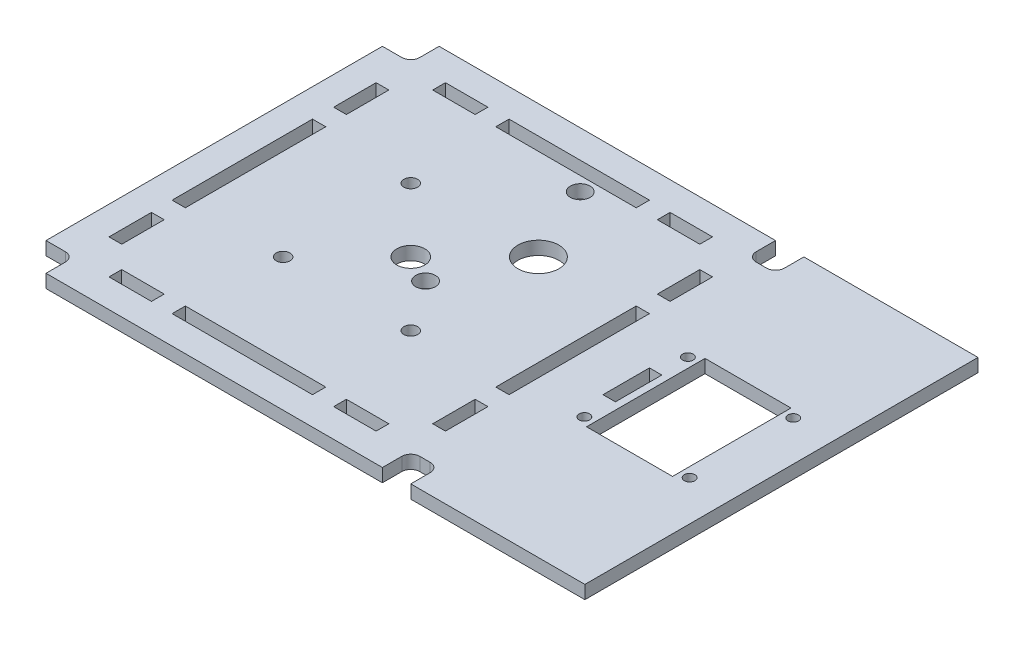
from build123d import *

# Parameters (mm, degrees)
EXTRUDE_1_DEPTH     = 88.9
SKETCH_4_R          = 1.5
SKETCH_4_W          = 31.75
SKETCH_4_H          = 3
SKETCH_4_W_2        = 3
SKETCH_4_H_2        = 31.75
CUT_EXTRUDE_1_DEPTH = 3
SKETCH_5_R          = 1.56
CUT_EXTRUDE_2_DEPTH = 3
SKETCH_7_R          = 4.635
SKETCH_7_R_2        = 2.23
CUT_EXTRUDE_3_DEPTH = 3
SKETCH_8_W          = 9.6
SKETCH_8_H          = 2.88
SKETCH_8_W_2        = 2.88
SKETCH_8_H_2        = 9.6
CUT_EXTRUDE_4_DEPTH = 3
SKETCH_9_R          = 3.175
CUT_EXTRUDE_5_DEPTH = 3
SKETCH_13_W         = 6.4135
SKETCH_13_H         = 6.4135
CUT_EXTRUDE_7_DEPTH = 5.08
FILLET_2_R          = 2.032
SKETCH_18_R         = 1.190625
SKETCH_18_W         = 19.446875
SKETCH_18_H         = 26.7890625
CUT_EXTRUDE_8_DEPTH = 3
SKETCH_19_W         = 2.804
SKETCH_19_H         = 10.5
CUT_EXTRUDE_9_DEPTH = 2000


with BuildPart() as part:
    # 스케치2 → 보스-돌출1 (new body)
    with BuildSketch(Plane.XY):
        Polygon((-44.45, 1.5), (44.45, 1.5), (83.82, 1.5), (83.82, -1.5), (44.45, -1.5), (-44.45, -1.5), align=None)
    extrude(amount=EXTRUDE_1_DEPTH)

    # 스케치4 → 컷-돌출1 (cut)
    with BuildSketch(Plane(origin=(0, 1.5, 0), x_dir=(1, 0, 0), z_dir=(0, 1, 0))):
        with Locations(Location((-41.275, -85.725, 0), (0, 0, 270))):
            Circle(SKETCH_4_R)
        with Locations(Location((-41.275, -3.175, 0), (0, 0, 270))):
            Circle(SKETCH_4_R)
        with Locations(Location((41.275, -3.175, 0), (0, 0, 270))):
            Circle(SKETCH_4_R)
        with Locations(Location((41.275, -85.725, 0), (0, 0, 270))):
            Circle(SKETCH_4_R)
        with Locations((0, -81.05)):
            Rectangle(SKETCH_4_W, SKETCH_4_H)
        with Locations((-36.6, -44.45)):
            Rectangle(SKETCH_4_W_2, SKETCH_4_H_2)
        with Locations((0, -7.85)):
            Rectangle(SKETCH_4_W, SKETCH_4_H)
        with Locations((36.6, -44.45)):
            Rectangle(SKETCH_4_W_2, SKETCH_4_H_2)
    extrude(amount=-CUT_EXTRUDE_1_DEPTH, mode=Mode.SUBTRACT)

    # 스케치5 → 컷-돌출2 (cut)
    with BuildSketch(Plane(origin=(0, 1.5, 0), x_dir=(1, 0, 0), z_dir=(0, 1, 0))):
        with Locations(Location((-14.431818182, -30.018181818, 0), (0, 0, 270))):
            Circle(SKETCH_5_R)
        with Locations(Location((14.431818182, -30.018181818, 0), (0, 0, 270))):
            Circle(SKETCH_5_R)
        with Locations(Location((14.431818182, -58.881818182, 0), (0, 0, 270))):
            Circle(SKETCH_5_R)
        with Locations(Location((-14.431818182, -58.881818182, 0), (0, 0, 270))):
            Circle(SKETCH_5_R)
    extrude(amount=-CUT_EXTRUDE_2_DEPTH, mode=Mode.SUBTRACT)

    # 스케치7 → 컷-돌출3 (cut)
    with BuildSketch(Plane(origin=(0, 1.5, 0), x_dir=(1, 0, 0), z_dir=(0, 1, 0))):
        with Locations(Location((14.431818182, -30.018181818, 0), (0, 0, 270))):
            Circle(SKETCH_7_R)
        with Locations((6.401818182, -47.508181818)):
            Circle(SKETCH_7_R_2)
        with Locations((6.401818182, -12.528181818)):
            Circle(SKETCH_7_R_2)
    extrude(amount=-CUT_EXTRUDE_3_DEPTH, mode=Mode.SUBTRACT)

    # 스케치8 → 컷-돌출4 (cut)
    with BuildSketch(Plane(origin=(0, 1.5, 0), x_dir=(1, 0, 0), z_dir=(0, 1, 0))):
        with Locations((-25.4, -7.85)):
            Rectangle(SKETCH_8_W, SKETCH_8_H)
        with Locations((-36.6, -19.05)):
            Rectangle(SKETCH_8_W_2, SKETCH_8_H_2)
        with Locations((36.6, -19.05)):
            Rectangle(SKETCH_8_W_2, SKETCH_8_H_2)
        with Locations((25.4, -7.85)):
            Rectangle(SKETCH_8_W, SKETCH_8_H)
        with Locations((36.6, -69.85)):
            Rectangle(SKETCH_8_W_2, SKETCH_8_H_2)
        with Locations((25.4, -81.05)):
            Rectangle(SKETCH_8_W, SKETCH_8_H)
        with Locations((-25.4, -81.05)):
            Rectangle(SKETCH_8_W, SKETCH_8_H)
        with Locations((-36.6, -69.85)):
            Rectangle(SKETCH_8_W_2, SKETCH_8_H_2)
    extrude(amount=-CUT_EXTRUDE_4_DEPTH, mode=Mode.SUBTRACT)

    # 스케치9 → 컷-돌출5 (cut)
    with BuildSketch(Plane(origin=(0, 1.5, 0), x_dir=(1, 0, 0), z_dir=(0, 1, 0))):
        with Locations(Location((0, -44.45, 0), (0, 0, 270))):
            Circle(SKETCH_9_R)
    extrude(amount=-CUT_EXTRUDE_5_DEPTH, mode=Mode.SUBTRACT)

    # 스케치13 → 컷-돌출7 (cut)
    with BuildSketch(Plane(origin=(0, 1.5, 0), x_dir=(1, 0, 0), z_dir=(0, 1, 0))):
        with Locations((-41.24325, -85.69325)):
            Rectangle(SKETCH_13_W, SKETCH_13_H)
        with Locations((-41.24325, -3.20675)):
            Rectangle(SKETCH_13_W, SKETCH_13_H)
        with Locations((41.24325, -3.20675)):
            Rectangle(SKETCH_13_W, SKETCH_13_H)
        with Locations((41.24325, -85.69325)):
            Rectangle(SKETCH_13_W, SKETCH_13_H)
    extrude(amount=-CUT_EXTRUDE_7_DEPTH, mode=Mode.SUBTRACT)

    # 필렛2
    fillet_2_edges = [part.edges().sort_by_distance(p)[0] for p in [
        (44.45, 0, 82.4865),
        (38.0365, 0, 82.4865),
        (44.45, 0, 6.4135),
        (38.0365, 0, 6.4135),
        (-38.0365, 0, 6.4135),
        (-38.0365, 0, 82.4865),
    ]]
    fillet(fillet_2_edges, radius=FILLET_2_R)

    # 스케치18 → 컷-돌출8 (cut)
    with BuildSketch(Plane(origin=(0, 1.5, 0), x_dir=(1, 0, 0), z_dir=(0, 1, 0))):
        with Locations(Location((50.95875, -56.1578125, 0), (0, 0, 180))):
            Circle(SKETCH_18_R)
        with Locations(Location((50.95875, -32.7421875, 0), (0, 0, 180))):
            Circle(SKETCH_18_R)
        with Locations((74.77125, -32.7421875)):
            Circle(SKETCH_18_R)
        with Locations((74.77125, -56.1578125)):
            Circle(SKETCH_18_R)
        with Locations((62.865, -44.45)):
            Rectangle(SKETCH_18_W, SKETCH_18_H)
    extrude(amount=-CUT_EXTRUDE_8_DEPTH, mode=Mode.SUBTRACT)

    # 스케치19 → 컷-돌출9 (cut)
    with BuildSketch(Plane(origin=(0, 1.5, 0), x_dir=(1, 0, 0), z_dir=(0, 1, 0))):
        with Locations((50.122375, -44.45)):
            Rectangle(SKETCH_19_W, SKETCH_19_H)
    extrude(amount=-CUT_EXTRUDE_9_DEPTH, mode=Mode.SUBTRACT)


solid = part.part
